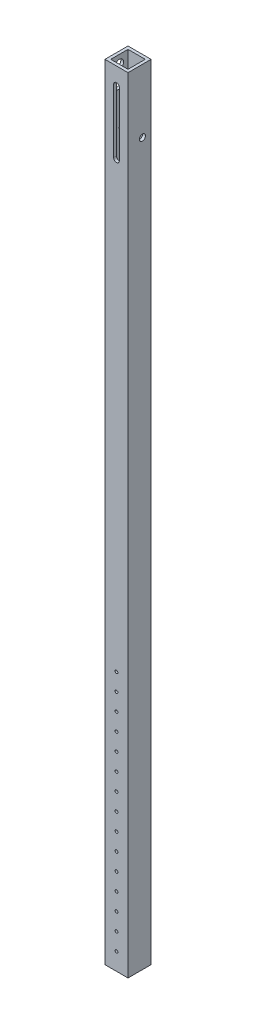
from build123d import *

# Parameters (mm, degrees)
SKETCH1_W           = 25.4
SKETCH1_H           = 25.4
SKETCH1_W_2         = 19.05
SKETCH1_H_2         = 19.05
BOSS_EXTRUDE1_DEPTH = 863.6
CUT_EXTRUDE1_REACH  = 866.067
CUT_EXTRUDE2_REACH  = 866.067
SKETCH4_R           = 3.3782
CUT_EXTRUDE3_DEPTH  = 865.066785613
CUT_EXTRUDE4_REACH  = 866.067
SKETCH5_R           = 4.7625
SKETCH6_R           = 1.5875
CUT_EXTRUDE5_DEPTH  = 865.066785613


with BuildPart() as part:
    # Sketch1 → Boss-Extrude1 (new body)
    with BuildSketch(Plane(origin=(0, 0, 0), x_dir=(1, 0, 0), z_dir=(0, 1, 0))):
        Rectangle(SKETCH1_W, SKETCH1_H)
        Rectangle(SKETCH1_W_2, SKETCH1_H_2, mode=Mode.SUBTRACT)
    extrude(amount=BOSS_EXTRUDE1_DEPTH)

    # Sketch2 → Cut-Extrude1 (cut, up to next)
    with BuildSketch(Plane(origin=(0, 0, -12.7), x_dir=(-1, 0, 0), z_dir=(0, 0, -1)), mode=Mode.PRIVATE) as cut_extrude1_sk1:
        with BuildLine():
            Line((-3.175, 711.2), (-3.175, 825.5))
            ThreePointArc((-3.175, 825.5), (0, 828.675), (3.175, 825.5))
            Line((3.175, 825.5), (3.175, 711.2))
            ThreePointArc((3.175, 711.2), (0, 708.025), (-3.175, 711.2))
        make_face()
    cut_extrude1_tool1 = extrude(cut_extrude1_sk1.sketch, amount=-CUT_EXTRUDE1_REACH, mode=Mode.PRIVATE) & part.part
    add(cut_extrude1_tool1.solids().sort_by_distance((0, 768.35, -12.7))[0], mode=Mode.SUBTRACT)

    # Sketch3 → Cut-Extrude2 (cut, up to next)
    with BuildSketch(Plane.XY.offset(12.7), mode=Mode.PRIVATE) as cut_extrude2_sk1:
        with BuildLine():
            Line((3.175, 844.55), (3.175, 774.7))
            ThreePointArc((3.175, 774.7), (0, 771.525), (-3.175, 774.7))
            Line((-3.175, 774.7), (-3.175, 844.55))
            ThreePointArc((-3.175, 844.55), (0, 847.725), (3.175, 844.55))
        make_face()
    cut_extrude2_tool1 = extrude(cut_extrude2_sk1.sketch, amount=-CUT_EXTRUDE2_REACH, mode=Mode.PRIVATE) & part.part
    add(cut_extrude2_tool1.solids().sort_by_distance((0, 809.625, 12.7))[0], mode=Mode.SUBTRACT)

    # Sketch4 → Cut-Extrude3 (cut, through all)
    with BuildSketch(Plane.ZY.offset(12.7)):
        with Locations((-3.175, 793.75)):
            Circle(SKETCH4_R)
    extrude(amount=-CUT_EXTRUDE3_DEPTH, mode=Mode.SUBTRACT)

    # Sketch5 → Cut-Extrude4 (cut, up to next)
    with BuildSketch(Plane.ZY.offset(12.7), mode=Mode.PRIVATE) as cut_extrude4_sk1:
        with Locations((0, 854.075)):
            Circle(SKETCH5_R)
    cut_extrude4_tool1 = extrude(cut_extrude4_sk1.sketch, amount=-CUT_EXTRUDE4_REACH, mode=Mode.PRIVATE) & part.part
    # Sketch5 → Cut-Extrude4 (cut, up to next)
    with BuildSketch(Plane.ZY.offset(12.7), mode=Mode.PRIVATE) as cut_extrude4_sk2:
        with Locations((0, 835.025)):
            Circle(SKETCH5_R)
    cut_extrude4_tool2 = extrude(cut_extrude4_sk2.sketch, amount=-CUT_EXTRUDE4_REACH, mode=Mode.PRIVATE) & part.part
    add(cut_extrude4_tool1.solids().sort_by_distance((-12.7, 854.075, 0))[0], mode=Mode.SUBTRACT)
    add(cut_extrude4_tool2.solids().sort_by_distance((-12.7, 835.025, 0))[0], mode=Mode.SUBTRACT)

    # Sketch6 → Cut-Extrude5 (cut, through all)
    with BuildSketch(Plane.XY.offset(12.7)):
        with Locations((0, 19.05)):
            Circle(SKETCH6_R)
        with Locations((0, 38.1)):
            Circle(SKETCH6_R)
        with Locations((0, 57.15)):
            Circle(SKETCH6_R)
        with Locations((0, 76.2)):
            Circle(SKETCH6_R)
        with Locations((0, 95.25)):
            Circle(SKETCH6_R)
        with Locations((0, 114.3)):
            Circle(SKETCH6_R)
        with Locations((0, 133.35)):
            Circle(SKETCH6_R)
        with Locations((0, 152.4)):
            Circle(SKETCH6_R)
        with Locations((0, 171.45)):
            Circle(SKETCH6_R)
        with Locations((0, 190.5)):
            Circle(SKETCH6_R)
        with Locations((0, 209.55)):
            Circle(SKETCH6_R)
        with Locations((0, 228.6)):
            Circle(SKETCH6_R)
        with Locations((0, 247.65)):
            Circle(SKETCH6_R)
        with Locations((0, 266.7)):
            Circle(SKETCH6_R)
        with Locations((0, 285.75)):
            Circle(SKETCH6_R)
    extrude(amount=-CUT_EXTRUDE5_DEPTH, mode=Mode.SUBTRACT)


solid = part.part
